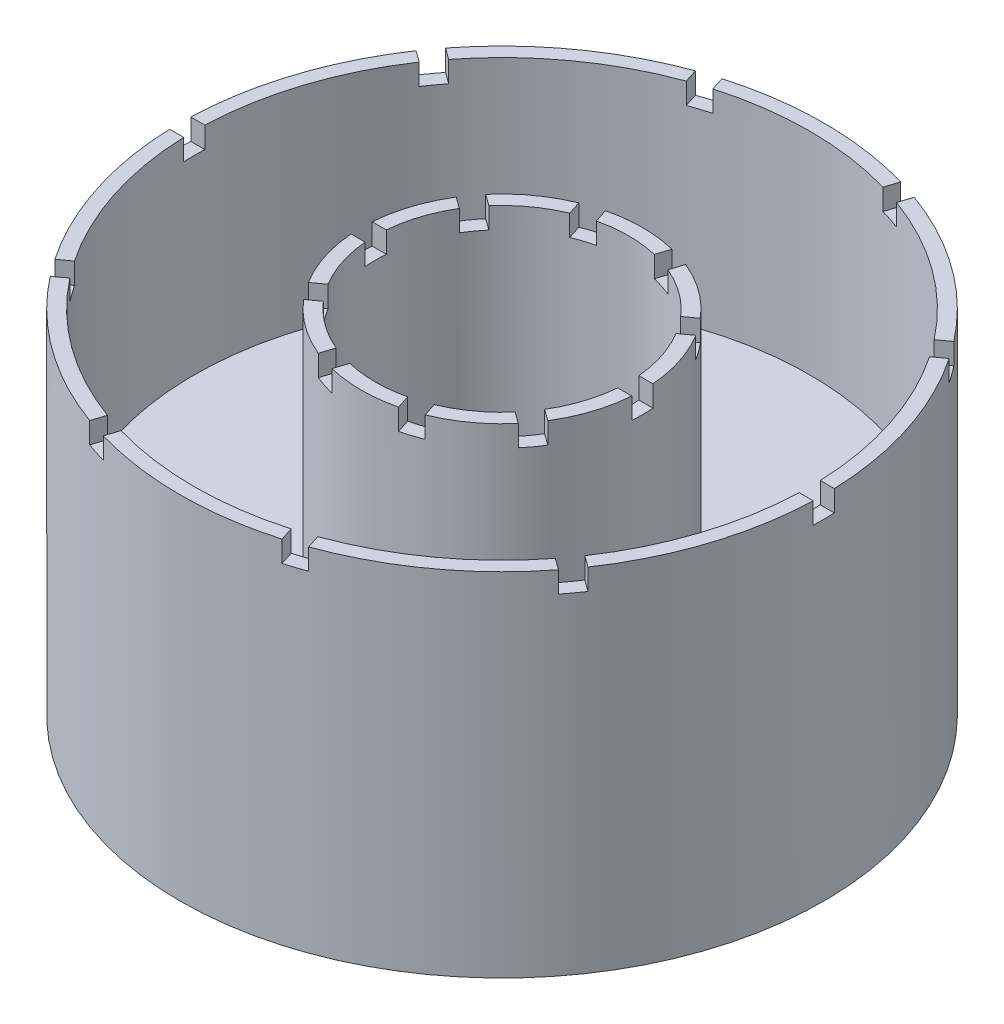
from build123d import *

# Parameters (mm, degrees)
SKETCH4_W          = 1.2
SKETCH4_H          = 1.2
CUT_EXTRUDE2_DEPTH = 29.526829477
CIRPATTERN1_COUNT  = 10


with BuildPart() as part:
    # Sketch1 → Revolve1 (revolve)
    with BuildSketch(Plane.XY, mode=Mode.PRIVATE) as revolve1_sk:
        Polygon((-7.2, -4), (-7.2, 12), (-8, 12), (-8, 0), (-17.5, 0), (-17.5, 12), (-18.3, 12), (-18.3, -8), (-4.3, -8), (-4.3, -4), align=None)
    revolve(revolve1_sk.sketch.rotate(Axis((0, 0, 0), (0, -1, 0)), 270), axis=Axis((0, 0, 0), (0, -1, 0)))

    # Sketch4 → Cut-Extrude2 (cut, through all)
    with BuildSketch(Plane(origin=(0, 0, 0), x_dir=(0, 0, -1), z_dir=(1, 0, 0))):
        with Locations((0, 11.4)):
            Rectangle(SKETCH4_W, SKETCH4_H)
    cut_extrude2 = extrude(amount=-CUT_EXTRUDE2_DEPTH, mode=Mode.SUBTRACT)

    # CirPattern1: Cut-Extrude2 ×10 about axis
    cirpattern1_axis = Axis((0, 0, 0), (0, 1, 0))
    for i in range(1, CIRPATTERN1_COUNT):
        add(cut_extrude2.rotate(cirpattern1_axis, i * 360 / CIRPATTERN1_COUNT), mode=Mode.SUBTRACT)


solid = part.part
